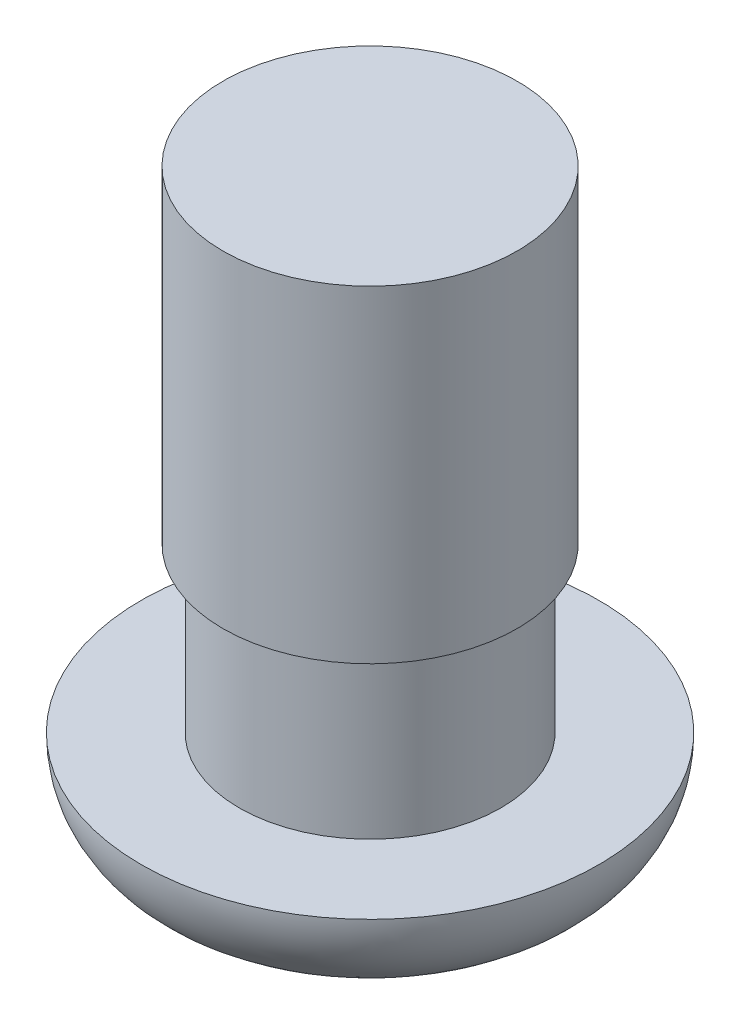
from build123d import *


with BuildPart() as part:
    # Esboço1 → Revolução1 (revolve)
    with BuildSketch(Plane(origin=(0, 0, 0), x_dir=(0, 0, -1), z_dir=(1, 0, 0))):
        with BuildLine():
            Line((0, 0), (-2, 0))
            ThreePointArc((-2, 0), (-3.060660172, 0.439339828), (-3.5, 1.5))
            Line((-3.5, 1.5), (-2, 1.5))
            Line((-2, 1.5), (-2, 4))
            Line((-2, 4), (-2.25, 4))
            Line((-2.25, 4), (-2.25, 9))
            Line((-2.25, 9), (0, 9))
            Line((0, 9), (0, 0))
        make_face()
    revolve(axis=Axis((0, 0, 0), (0, -1, 0)))


solid = part.part
